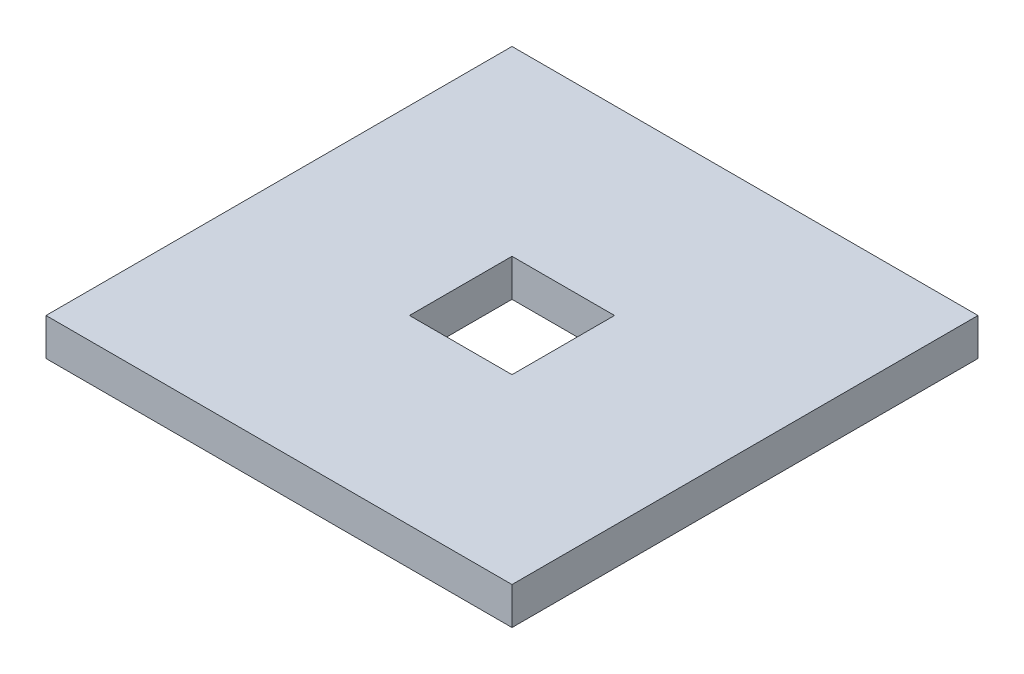
from build123d import *

# Parameters (mm, degrees)
SKETCH1_W           = 250
SKETCH1_H           = 250
SKETCH1_W_2         = 55
SKETCH1_H_2         = 55
BOSS_EXTRUDE1_DEPTH = 20


with BuildPart() as part:
    # Sketch1 → Boss-Extrude1 (new body)
    with BuildSketch(Plane(origin=(0, 0, 0), x_dir=(1, 0, 0), z_dir=(0, 1, 0))):
        Rectangle(SKETCH1_W, SKETCH1_H)
        Rectangle(SKETCH1_W_2, SKETCH1_H_2, mode=Mode.SUBTRACT)
    extrude(amount=BOSS_EXTRUDE1_DEPTH)


solid = part.part
